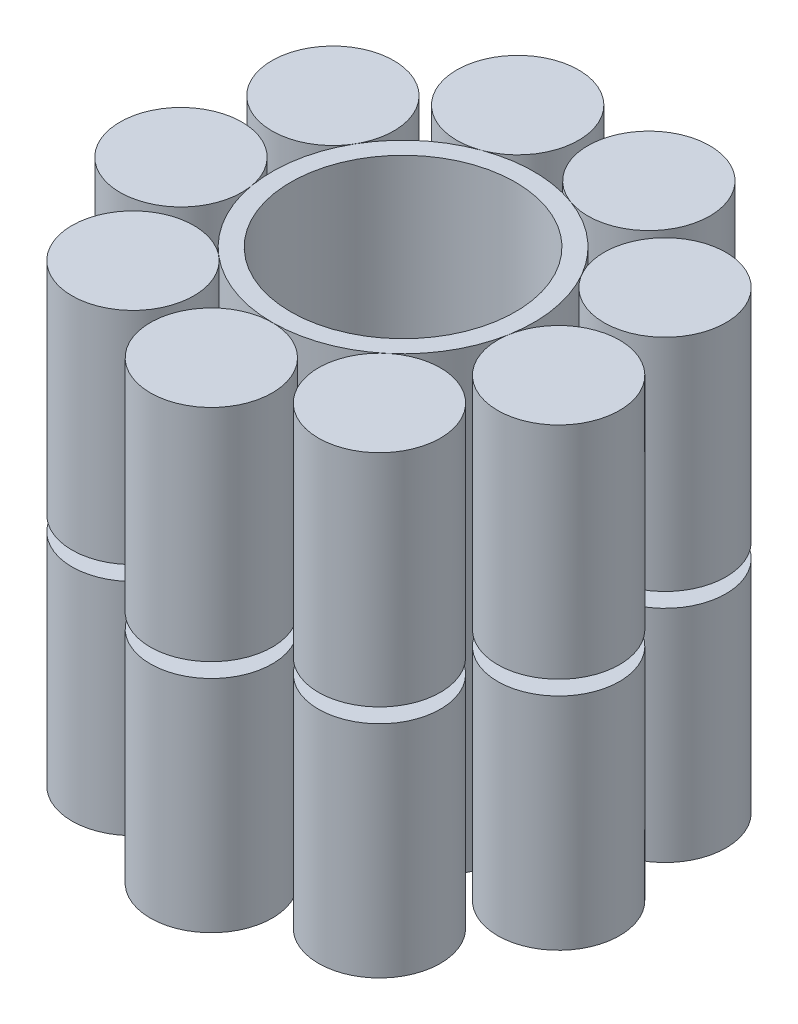
from build123d import *

# Parameters (mm, degrees)
SKETCH1_R               = 36.5125
SKETCH1_R_2             = 31.369
BOSS_EXTRUDE1_DEPTH     = 127
SKETCH2_R               = 17.018
BOSS_EXTRUDE2_DEPTH     = 127
CIRPATTERN3_COUNT       = 9
CUT_EXTRUDE1_DEPTH      = 2.032
CUT_EXTRUDE1_DEPTH_BACK = 2.032
SKETCH5_R               = 70.5485
SKETCH5_R_2             = 36.5125


with BuildPart() as part:
    # Sketch1 → Boss-Extrude1 (new body)
    with BuildSketch(Plane(origin=(0, 0, 0), x_dir=(1, 0, 0), z_dir=(0, 1, 0))):
        with Locations(Location((0, 0, 0), (0, 0, 270))):
            Circle(SKETCH1_R)
        with Locations(Location((0, 0, 0), (0, 0, 270))):
            Circle(SKETCH1_R_2, mode=Mode.SUBTRACT)
    extrude(amount=BOSS_EXTRUDE1_DEPTH)


with BuildPart() as body_2:
    # Sketch2 → Boss-Extrude2 (new body)
    with BuildSketch(Plane(origin=(0, 0, 0), x_dir=(1, 0, 0), z_dir=(0, 1, 0))):
        with Locations(Location((0, -53.5305, 0), (0, 0, 270))):
            Circle(SKETCH2_R)
    extrude(amount=BOSS_EXTRUDE2_DEPTH)


with BuildPart() as cirpattern3_1:
    # CirPattern3: pattern copy
    add(body_2.part.rotate(Axis((0, 0, 0), (0, 1, 0)), 1 * 360 / CIRPATTERN3_COUNT))


with BuildPart() as cirpattern3_2:
    # CirPattern3: pattern copy
    add(body_2.part.rotate(Axis((0, 0, 0), (0, 1, 0)), 2 * 360 / CIRPATTERN3_COUNT))


with BuildPart() as cirpattern3_3:
    # CirPattern3: pattern copy
    add(body_2.part.rotate(Axis((0, 0, 0), (0, 1, 0)), 3 * 360 / CIRPATTERN3_COUNT))


with BuildPart() as cirpattern3_4:
    # CirPattern3: pattern copy
    add(body_2.part.rotate(Axis((0, 0, 0), (0, 1, 0)), 4 * 360 / CIRPATTERN3_COUNT))


with BuildPart() as cirpattern3_5:
    # CirPattern3: pattern copy
    add(body_2.part.rotate(Axis((0, 0, 0), (0, 1, 0)), 5 * 360 / CIRPATTERN3_COUNT))


with BuildPart() as cirpattern3_6:
    # CirPattern3: pattern copy
    add(body_2.part.rotate(Axis((0, 0, 0), (0, 1, 0)), 6 * 360 / CIRPATTERN3_COUNT))


with BuildPart() as cirpattern3_7:
    # CirPattern3: pattern copy
    add(body_2.part.rotate(Axis((0, 0, 0), (0, 1, 0)), 7 * 360 / CIRPATTERN3_COUNT))


with BuildPart() as cirpattern3_8:
    # CirPattern3: pattern copy
    add(body_2.part.rotate(Axis((0, 0, 0), (0, 1, 0)), 8 * 360 / CIRPATTERN3_COUNT))


with BuildPart() as cut_extrude1_tool:
    # Sketch5 → Cut-Extrude1 (new, two sides: drawn at the far end of the back side and taken through both)
    with BuildSketch(Plane(origin=(0, 63.5, 0), x_dir=(1, 0, 0), z_dir=(0, 1, 0)).offset(-CUT_EXTRUDE1_DEPTH_BACK)):
        Circle(SKETCH5_R)
        with Locations(Location((0, 0, 0), (0, 0, 270))):
            Circle(SKETCH5_R_2, mode=Mode.SUBTRACT)
    extrude(amount=CUT_EXTRUDE1_DEPTH + CUT_EXTRUDE1_DEPTH_BACK)


with BuildPart() as body_2_1:
    add(body_2.part)

    # Cut-Extrude1: cut by cut_extrude1_tool
    add(cut_extrude1_tool.part, mode=Mode.SUBTRACT)


with BuildPart() as cirpattern3_1_1:
    add(cirpattern3_1.part)

    # Cut-Extrude1: cut by cut_extrude1_tool
    add(cut_extrude1_tool.part, mode=Mode.SUBTRACT)


with BuildPart() as cirpattern3_2_1:
    add(cirpattern3_2.part)

    # Cut-Extrude1: cut by cut_extrude1_tool
    add(cut_extrude1_tool.part, mode=Mode.SUBTRACT)


with BuildPart() as cirpattern3_3_1:
    add(cirpattern3_3.part)

    # Cut-Extrude1: cut by cut_extrude1_tool
    add(cut_extrude1_tool.part, mode=Mode.SUBTRACT)


with BuildPart() as cirpattern3_4_1:
    add(cirpattern3_4.part)

    # Cut-Extrude1: cut by cut_extrude1_tool
    add(cut_extrude1_tool.part, mode=Mode.SUBTRACT)


with BuildPart() as cirpattern3_5_1:
    add(cirpattern3_5.part)

    # Cut-Extrude1: cut by cut_extrude1_tool
    add(cut_extrude1_tool.part, mode=Mode.SUBTRACT)


with BuildPart() as cirpattern3_6_1:
    add(cirpattern3_6.part)

    # Cut-Extrude1: cut by cut_extrude1_tool
    add(cut_extrude1_tool.part, mode=Mode.SUBTRACT)


with BuildPart() as cirpattern3_7_1:
    add(cirpattern3_7.part)

    # Cut-Extrude1: cut by cut_extrude1_tool
    add(cut_extrude1_tool.part, mode=Mode.SUBTRACT)


with BuildPart() as cirpattern3_8_1:
    add(cirpattern3_8.part)

    # Cut-Extrude1: cut by cut_extrude1_tool
    add(cut_extrude1_tool.part, mode=Mode.SUBTRACT)


solid = Compound([part.part, body_2_1.part, cirpattern3_1_1.part, cirpattern3_2_1.part, cirpattern3_3_1.part, cirpattern3_4_1.part, cirpattern3_5_1.part, cirpattern3_6_1.part, cirpattern3_7_1.part, cirpattern3_8_1.part])
